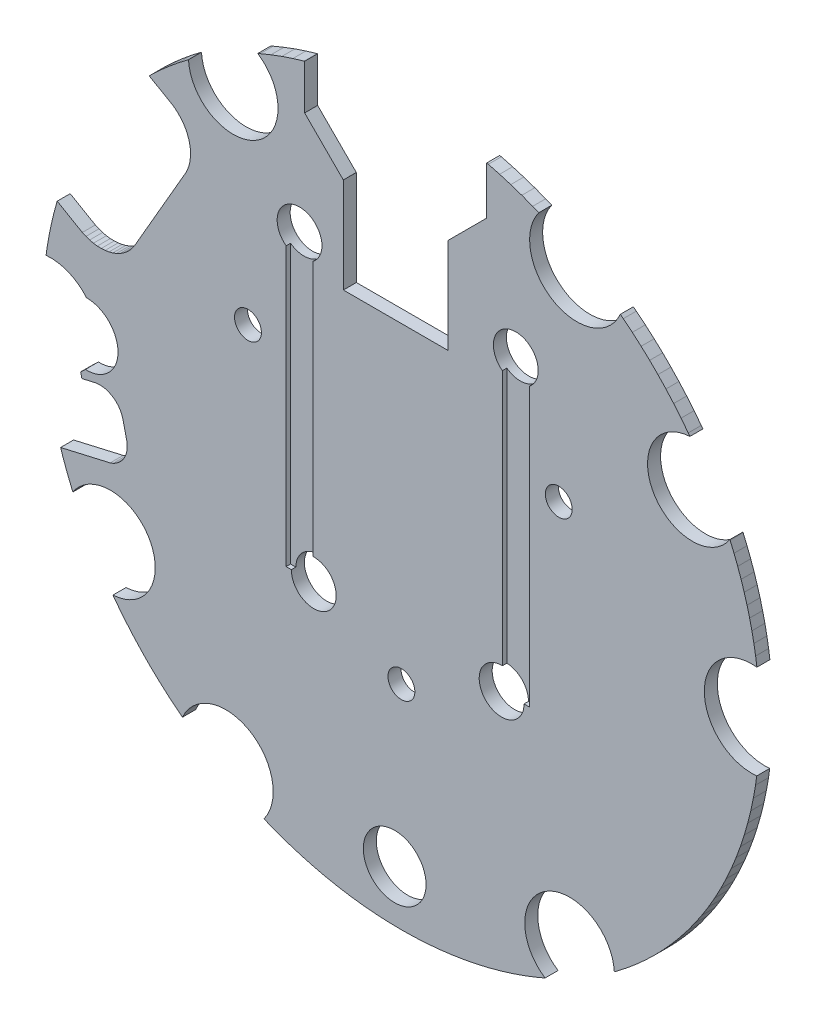
from build123d import *
from build123d.topology import SkipClean

# Parameters (mm, degrees)
SZKIC1_R                    = 3
DODANIE_WYCI_GNI_CIE1_DEPTH = 2.9
CUT_EXTRUDE1_DEPTH          = 1
SKETCH2_R                   = 5
CUT_EXTRUDE2_DEPTH          = 113.717798255
SKETCH3_R                   = 7
CUT_EXTRUDE3_DEPTH          = 113.717798255


with BuildPart() as part:
    # Szkic1 → Dodanie-wyciągnięcie1 (new body)
    with BuildSketch(Plane.XY):
        with BuildLine():
            Line((-71.57962062, -7.983371532), (-71.312597874, -9.139973792))
            Line((-71.312597874, -9.139973792), (-68.53523504, -8.49876888))
            Line((-68.53523504, -8.49876888), (-68.19394794, -8.41997808))
            Line((-68.19394794, -8.41997808), (-67.49664428, -8.35283572))
            Line((-67.49664428, -8.35283572), (-66.79654408, -8.37728322))
            Line((-66.79654408, -8.37728322), (-66.10562344, -8.49290402))
            Line((-66.10562344, -8.49290402), (-65.43570352, -8.69771946))
            Line((-65.43570352, -8.69771946), (-64.79824988, -8.98822434))
            Line((-64.79824988, -8.98822434), (-64.20416928, -9.35944788))
            Line((-64.20416928, -9.35944788), (-63.66362426, -9.80504008))
            Line((-63.66362426, -9.80504008), (-63.1858655, -10.31737332))
            Line((-63.1858655, -10.31737332), (-62.77906926, -10.8876846))
            Line((-62.77906926, -10.8876846), (-62.45019006, -11.50621524))
            Line((-62.45019006, -11.50621524), (-62.20486162, -12.1623836))
            Line((-62.20486162, -12.1623836), (-62.1260632, -12.50366054))
            Line((-62.1260632, -12.50366054), (-61.33063934, -15.94903846))
            Line((-61.33063934, -15.94903846), (-61.25184854, -16.29032556))
            Line((-61.25184854, -16.29032556), (-61.18470618, -16.98762922))
            Line((-61.18470618, -16.98762922), (-61.20915368, -17.68772942))
            Line((-61.20915368, -17.68772942), (-61.32477448, -18.37865006))
            Line((-61.32477448, -18.37865006), (-61.52958738, -19.04856998))
            Line((-61.52958738, -19.04856998), (-61.82009226, -19.68602362))
            Line((-61.82009226, -19.68602362), (-62.1913158, -20.28010422))
            Line((-62.1913158, -20.28010422), (-62.63690546, -20.82064924))
            Line((-62.63690546, -20.82064924), (-63.14924124, -21.298408))
            Line((-63.14924124, -21.298408), (-63.71955252, -21.70520678))
            Line((-63.71955252, -21.70520678), (-64.33808062, -22.03408598))
            Line((-64.33808062, -22.03408598), (-64.99424644, -22.27941442))
            Line((-64.99424644, -22.27941442), (-65.33552338, -22.35820776))
            Line((-65.33552338, -22.35820776), (-76.05586516, -24.83318884))
            Line((-76.05586516, -24.83318884), (-75.54626496, -26.37281238))
            Line((-75.54626496, -26.37281238), (-74.65067366, -28.8104199))
            Line((-74.65067366, -28.8104199), (-73.67645158, -31.21768458))
            Line((-73.67645158, -31.21768458), (-73.304524984, -32.057268652))
            ThreePointArc((-73.304524984, -32.057268652), (-56.277053256, -32.525271386), (-64.370269597, -47.513722582))
            Line((-64.370269597, -47.513722582), (-63.5862457, -48.5784144))
            Line((-63.5862457, -48.5784144), (-61.8316772, -50.79288038))
            Line((-61.8316772, -50.79288038), (-60.00002478, -52.9440267))
            Line((-60.00002478, -52.9440267), (-58.09357698, -55.02916858))
            Line((-58.09357698, -55.02916858), (-56.11470362, -57.0457076))
            Line((-56.11470362, -57.0457076), (-54.06587612, -58.99113424))
            Line((-54.06587612, -58.99113424), (-51.94964972, -60.86301772))
            Line((-51.94964972, -60.86301772), (-49.7686584, -62.65902632))
            Line((-49.7686584, -62.65902632), (-48.854025047, -63.359525568))
            ThreePointArc((-48.854025047, -63.359525568), (-33.882392112, -58.494836786), (-30.664292357, -73.904535798))
            Line((-30.664292357, -73.904535798), (-30.33088422, -74.04802818))
            Line((-30.33088422, -74.04802818), (-27.69790498, -75.07262354))
            Line((-27.69790498, -75.07262354), (-25.03039952, -76.0036326))
            Line((-25.03039952, -76.0036326), (-22.33168762, -76.8398895))
            Line((-22.33168762, -76.8398895), (-19.60513732, -77.58035538))
            Line((-19.60513732, -77.58035538), (-16.8541446, -78.22410568))
            Line((-16.8541446, -78.22410568), (-14.082141, -78.77033776))
            Line((-14.082141, -78.77033776), (-11.29258346, -79.2183709))
            Line((-11.29258346, -79.2183709), (-8.4889467, -79.56764884))
            Line((-8.4889467, -79.56764884), (-5.6747283, -79.81773216))
            Line((-5.6747283, -79.81773216), (-2.85343346, -79.96831098))
            Line((-2.85343346, -79.96831098), (-0.02858516, -80.0191948))
            Line((-0.02858516, -80.0191948), (2.79630124, -79.97032774))
            Line((2.79630124, -79.97032774), (5.61770276, -79.82176568))
            Line((5.61770276, -79.82176568), (8.43209896, -79.5736915))
            Line((8.43209896, -79.5736915), (11.23598464, -79.22641762))
            Line((11.23598464, -79.22641762), (14.02586222, -78.78037838))
            Line((14.02586222, -78.78037838), (16.79825444, -78.23612496))
            Line((16.79825444, -78.23612496), (19.54970436, -77.59434062))
            Line((19.54970436, -77.59434062), (22.27678552, -76.85582292))
            Line((22.27678552, -76.85582292), (24.97609178, -76.02149388))
            Line((24.97609178, -76.02149388), (27.64426526, -75.09239236))
            Line((27.64426526, -75.09239236), (30.27797348, -74.0696766))
            Line((30.27797348, -74.0696766), (32.058084413, -73.305058296))
            ThreePointArc((32.058084413, -73.305058296), (32.526945476, -56.276085802), (47.513994724, -64.375103628))
            Line((47.513994724, -64.375103628), (47.99231702, -64.02949094))
            Line((47.99231702, -64.02949094), (50.20371976, -62.31071104))
            Line((50.20371976, -62.31071104), (52.35361386, -60.51559398))
            Line((52.35361386, -60.51559398), (54.43937042, -58.6463394))
            Line((54.43937042, -58.6463394), (56.45843166, -56.7052333))
            Line((56.45843166, -56.7052333), (58.40832616, -54.6946582))
            Line((58.40832616, -54.6946582), (60.28666124, -52.61707536))
            Line((60.28666124, -52.61707536), (62.0911382, -50.47502986))
            Line((62.0911382, -50.47502986), (63.8195447, -48.27114806))
            Line((63.8195447, -48.27114806), (65.46976746, -46.0081249))
            Line((65.46976746, -46.0081249), (67.03977956, -43.68873914))
            Line((67.03977956, -43.68873914), (68.52766076, -41.31582796))
            Line((68.52766076, -41.31582796), (69.93158734, -38.89229966))
            Line((69.93158734, -38.89229966), (71.24983972, -36.42112604))
            Line((71.24983972, -36.42112604), (72.48080246, -33.9053297))
            Line((72.48080246, -33.9053297), (73.6229668, -31.34799674))
            Line((73.6229668, -31.34799674), (74.6749332, -28.75225644))
            Line((74.6749332, -28.75225644), (75.63541642, -26.12129396))
            Line((75.63541642, -26.12129396), (76.50323536, -23.45832748))
            Line((76.50323536, -23.45832748), (77.2773283, -20.76662344))
            Line((77.2773283, -20.76662344), (77.95674782, -18.04947622))
            Line((77.95674782, -18.04947622), (78.5406608, -15.31021576))
            Line((78.5406608, -15.31021576), (79.02835096, -12.55219994))
            Line((79.02835096, -12.55219994), (79.299411436, -10.628909904))
            ThreePointArc((79.299411436, -10.628909904), (67.599207973, -0.09719794), (79.333602634, 10.39640487))
            Line((79.333602634, 10.39640487), (79.04494478, 12.42009454))
            Line((79.04494478, 12.42009454), (78.6613108, 14.6546951))
            Line((78.6613108, 14.6546951), (78.21451972, 16.87752784))
            Line((78.21451972, 16.87752784), (77.70492714, 19.08680968))
            Line((77.70492714, 19.08680968), (77.13294454, 21.28076516))
            Line((77.13294454, 21.28076516), (76.49902912, 23.45763406))
            Line((76.49902912, 23.45763406), (75.80368888, 25.61566886))
            Line((75.80368888, 25.61566886), (75.0474877, 27.75313728))
            Line((75.0474877, 27.75313728), (74.23102756, 29.86831974))
            Line((74.23102756, 29.86831974), (73.35496378, 31.95952206))
            Line((73.35496378, 31.95952206), (73.308184112, 32.062869193))
            ThreePointArc((73.308184112, 32.062869193), (56.277888121, 32.52382733), (64.373618175, 47.513911347))
            Line((64.373618175, 47.513911347), (64.00781966, 48.0183825))
            Line((64.00781966, 48.0183825), (62.41427192, 50.07219348))
            Line((62.41427192, 50.07219348), (60.75485182, 52.07315976))
            Line((60.75485182, 52.07315976), (59.03130942, 54.01916806))
            Line((59.03130942, 54.01916806), (57.2454659, 55.90816352))
            Line((57.2454659, 55.90816352), (55.3992034, 57.73815224))
            Line((55.3992034, 57.73815224), (53.49447264, 59.50720382))
            Line((53.49447264, 59.50720382), (51.53328276, 61.21345136))
            Line((51.53328276, 61.21345136), (49.5177064, 62.855094))
            Line((49.5177064, 62.855094), (48.854412275, 63.360399614))
            ThreePointArc((48.854412275, 63.360399614), (33.885789996, 58.492867797), (30.660209654, 73.898975364))
            Line((30.660209654, 73.898975364), (29.29812276, 74.46063594))
            Line((29.29812276, 74.46063594), (26.86397218, 75.3730268))
            Line((26.86397218, 75.3730268), (24.40147012, 76.2058674))
            Line((24.40147012, 76.2058674), (21.913215, 76.95828144))
            Line((21.913215, 76.95828144), (19.40183064, 77.6294739))
            Line((19.40183064, 77.6294739), (19.04364746, 77.7128367))
            Line((19.04364746, 77.7128367), (19.04365, 67.0536505))
            Line((19.04365, 67.0536505), (10.41764998, 58.42765048))
            Line((10.41764998, 58.42765048), (10.41764998, 37.15114998))
            Line((10.41764998, 37.15114998), (-12.95035002, 37.15114998))
            Line((-12.95035002, 37.15114998), (-12.95035256, 58.4176505))
            Line((-12.95035256, 58.4176505), (-12.96035, 58.4176505))
            Line((-12.96035, 58.4176505), (-21.59635, 67.0536505))
            Line((-21.59635, 67.0536505), (-21.59635254, 77.04573364))
            Line((-21.59635254, 77.04573364), (-21.72109448, 77.01272888))
            Line((-21.72109448, 77.01272888), (-24.21122158, 76.26652768))
            Line((-24.21122158, 76.26652768), (-26.67579374, 75.43983134))
            Line((-26.67579374, 75.43983134), (-29.11221254, 74.5335187))
            Line((-29.11221254, 74.5335187), (-31.5179075, 73.54853972))
            Line((-31.5179075, 73.54853972), (-32.059481022, 73.305971081))
            ThreePointArc((-32.059481022, 73.305971081), (-32.526681058, 56.27623858), (-47.514053862, 64.376159651))
            Line((-47.514053862, 64.376159651), (-47.84248242, 64.13937642))
            Line((-47.84248242, 64.13937642), (-49.89862766, 62.55309562))
            Line((-49.89862766, 62.55309562), (-51.90221522, 60.90092722))
            Line((-51.90221522, 60.90092722), (-53.85113436, 59.18461366))
            Line((-53.85113436, 59.18461366), (-55.74333022, 57.40595834))
            Line((-55.74333022, 57.40595834), (-56.27645844, 56.87119182))
            Line((-56.27645844, 56.87119182), (-51.51362062, 54.1213675))
            Line((-51.51362062, 54.1213675), (-51.13540192, 53.90299608))
            Line((-51.13540192, 53.90299608), (-50.4254008, 53.3942163))
            Line((-50.4254008, 53.3942163), (-49.76868634, 52.81829416))
            Line((-49.76868634, 52.81829416), (-49.17158314, 52.18077702))
            Line((-49.17158314, 52.18077702), (-48.6398443, 51.48780152))
            Line((-48.6398443, 51.48780152), (-48.17859046, 50.74604532))
            Line((-48.17859046, 50.74604532), (-47.79226154, 49.96264836))
            Line((-47.79226154, 49.96264836), (-47.48457864, 49.14515698))
            Line((-47.48457864, 49.14515698), (-47.25850594, 48.30144518))
            Line((-47.25850594, 48.30144518), (-47.11622022, 47.43963588))
            Line((-47.11622022, 47.43963588), (-47.05909308, 46.5680298))
            Line((-47.05909308, 46.5680298), (-47.08767062, 45.69502164))
            Line((-47.08767062, 45.69502164), (-47.2016836, 44.8290188))
            Line((-47.2016836, 44.8290188), (-47.40002966, 43.97836264))
            Line((-47.40002966, 43.97836264), (-47.68079872, 43.15124212))
            Line((-47.68079872, 43.15124212), (-48.04128822, 42.35562268))
            Line((-48.04128822, 42.35562268), (-48.2596571, 41.9773989))
            Line((-48.2596571, 41.9773989), (-59.43565202, 22.62000048))
            Line((-59.43565202, 22.62000048), (-59.65402598, 22.24177416))
            Line((-59.65402598, 22.24177416), (-60.16280576, 21.53177304))
            Line((-60.16280576, 21.53177304), (-60.7387279, 20.87506112))
            Line((-60.7387279, 20.87506112), (-61.37624758, 20.27795792))
            Line((-61.37624758, 20.27795792), (-62.06922054, 19.74622162))
            Line((-62.06922054, 19.74622162), (-62.81097928, 19.28496778))
            Line((-62.81097928, 19.28496778), (-63.5943737, 18.89863886))
            Line((-63.5943737, 18.89863886), (-64.41186508, 18.59095596))
            Line((-64.41186508, 18.59095596), (-65.25557688, 18.3648858))
            Line((-65.25557688, 18.3648858), (-66.11738618, 18.22260008))
            Line((-66.11738618, 18.22260008), (-66.98898972, 18.16547294))
            Line((-66.98898972, 18.16547294), (-67.86199788, 18.19405048))
            Line((-67.86199788, 18.19405048), (-68.72800072, 18.30806346))
            Line((-68.72800072, 18.30806346), (-69.57865688, 18.50640698))
            Line((-69.57865688, 18.50640698), (-70.4057774, 18.78717858))
            Line((-70.4057774, 18.78717858), (-71.2013943, 19.14766554))
            Line((-71.2013943, 19.14766554), (-71.57962062, 19.36603442))
            Line((-71.57962062, 19.36603442), (-76.81740034, 22.39006698))
            Line((-76.81740034, 22.39006698), (-76.88341494, 22.17438796))
            Line((-76.88341494, 22.17438796), (-77.56249156, 19.66782198))
            Line((-77.56249156, 19.66782198), (-78.15986908, 17.14053976))
            Line((-78.15986908, 17.14053976), (-78.67492266, 14.59520068))
            Line((-78.67492266, 14.59520068), (-79.1071062, 12.03449206))
            Line((-79.1071062, 12.03449206), (-79.289748918, 10.687222926))
            ThreePointArc((-79.289748918, 10.687222926), (-68.55606183, 4.192492209), (-71.57962062, -7.983371532))
        make_face()
        with Locations((0, -32.5400162)):
            Circle(SZKIC1_R, mode=Mode.SUBTRACT)
        with Locations((35.10868772, 20.27001026)):
            Circle(SZKIC1_R, mode=Mode.SUBTRACT)
        with Locations((-34.24266202, 19.77001126)):
            Circle(SZKIC1_R, mode=Mode.SUBTRACT)
    extrude(amount=DODANIE_WYCI_GNI_CIE1_DEPTH)

    # Sketch1 → Cut-Extrude1 (cut)
    with BuildSketch(Plane.XY.offset(2.9)):
        with BuildLine():
            Line((22.5310005, 39.310999375), (22.5310005, -17.732064063))
            ThreePointArc((22.5310005, -17.732064063), (18.773048188, -26.216471447), (27.355840497, -22.689000625))
            Line((27.355840497, -22.689000625), (28.5310005, -22.689000625))
            Line((28.5310005, -22.689000625), (28.5310005, 39.310999375))
            ThreePointArc((28.5310005, 39.310999375), (25.5310005, 48.310999375), (22.5310005, 39.310999375))
        make_face()
        with BuildLine():
            Line((-19.7289995, 39.310999375), (-19.7289995, -17.732064063))
            ThreePointArc((-19.7289995, -17.732064063), (-15.968393489, -26.213743016), (-24.553894601, -22.696612641))
            Line((-24.553894601, -22.696612641), (-25.7289995, -22.689000625))
            Line((-25.7289995, -22.689000625), (-25.7289995, 39.310999375))
            ThreePointArc((-25.7289995, 39.310999375), (-22.7289995, 48.310999375), (-19.7289995, 39.310999375))
        make_face()
    extrude(amount=-CUT_EXTRUDE1_DEPTH, mode=Mode.SUBTRACT)

    # Sketch2 → Cut-Extrude2 (cut, through all)
    with SkipClean():  # the faces are left unmerged after this step: merging them gives an invalid solid
        with BuildSketch(Plane.XY.offset(2.9)):
            with Locations((-22.7289995, 43.310999375)):
                Circle(SKETCH2_R)
            with Locations((25.5310005, 43.310999375)):
                Circle(SKETCH2_R)
            with Locations((22.3560005, -22.729000625)):
                Circle(SKETCH2_R)
            with Locations((-19.5539995, -22.729000625)):
                Circle(SKETCH2_R)
        extrude(amount=-CUT_EXTRUDE2_DEPTH, mode=Mode.SUBTRACT)

    # Sketch3 → Cut-Extrude3 (cut, through all)
    with SkipClean():  # the faces are left unmerged after this step: merging them gives an invalid solid
        with BuildSketch(Plane.XY.offset(2.9)):
            with Locations((-1.5, -68.5400162)):
                Circle(SKETCH3_R)
            with Locations((-70.24266202, 0)):
                Circle(SKETCH3_R)
        extrude(amount=-CUT_EXTRUDE3_DEPTH, mode=Mode.SUBTRACT)


solid = part.part
